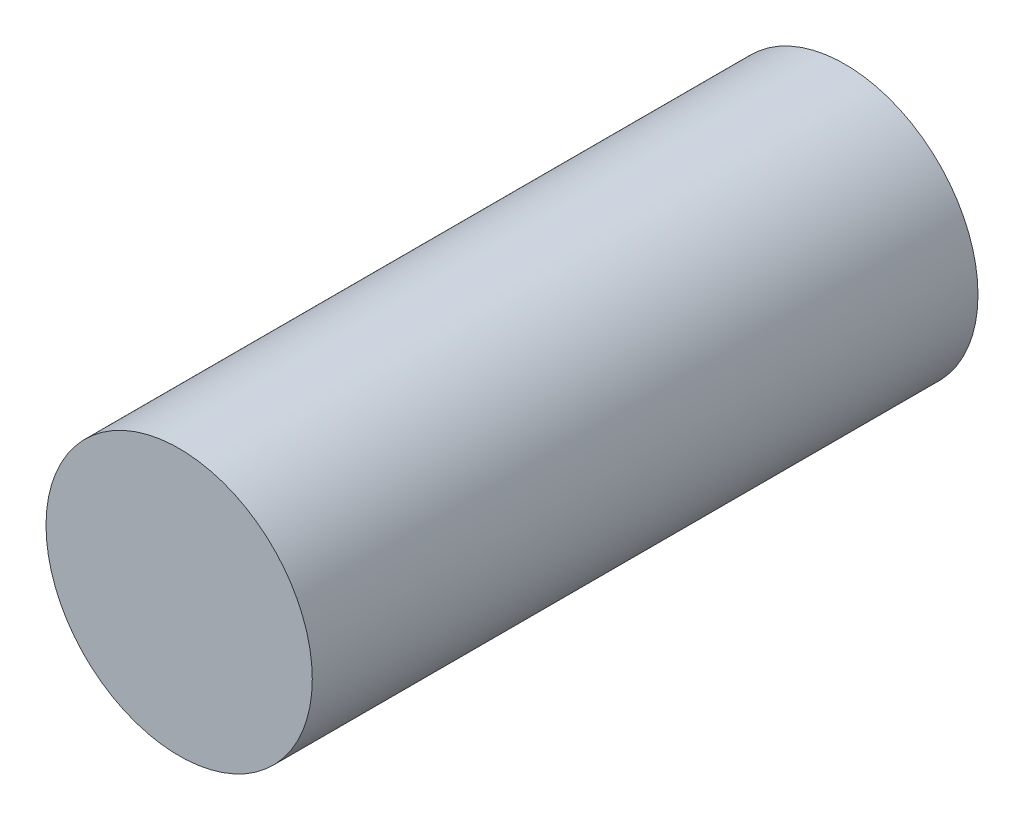
from build123d import *

# Parameters (mm, degrees)
SKETCH1_R           = 5
BOSS_EXTRUDE1_DEPTH = 25


with BuildPart() as part:
    # Sketch1 → Boss-Extrude1 (new body)
    with BuildSketch(Plane.XY):
        Circle(SKETCH1_R)
    extrude(amount=BOSS_EXTRUDE1_DEPTH)


solid = part.part
